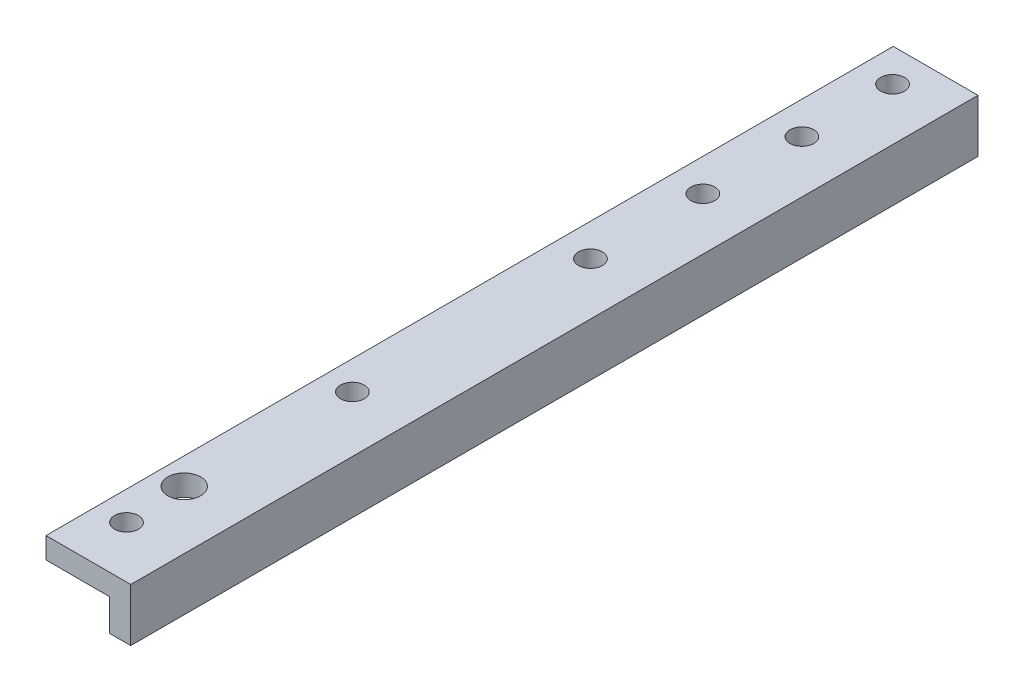
from build123d import *

# Parameters (mm, degrees)
BOSS_EXTRUDE1_DEPTH  = 160
M4_CLEARANCE_HOLE1_D = 4.5
CUT_EXTRUDE2_REACH   = 163.357
SKETCH5_R            = 3.1


with BuildPart() as part:
    # Sketch1 → Boss-Extrude1 (new body)
    with BuildSketch(Plane.XY):
        Polygon((4, -4), (16, -4), (16, -10), (20, -10), (20, 0), (16, 0), (4, 0), align=None)
    extrude(amount=BOSS_EXTRUDE1_DEPTH)

    # M4 Clearance Hole1 (through all)
    with Locations(Plane(origin=(0, -4, 0), x_dir=(-1, 0, 0), z_dir=(0, -1, 0))):
        with Locations((-10.128911503, -6.267286375), (-10.128911503, -23.38156703), (-10.128911503, -42.093180546), (-10.128911503, -63.314888558), (-9.444340277, -107.583827852), (-9.444340277, -150.244789298)):
            Hole(M4_CLEARANCE_HOLE1_D / 2)

    # Sketch5 → Cut-Extrude2 (cut, up to next)
    with BuildSketch(Plane.XZ.offset(4), mode=Mode.PRIVATE) as cut_extrude2_sk1:
        with Locations(Location((9, 138.897931951, 0), (0, 0, 270))):
            Circle(SKETCH5_R)
    cut_extrude2_tool1 = extrude(cut_extrude2_sk1.sketch, amount=-CUT_EXTRUDE2_REACH, mode=Mode.PRIVATE) & part.part
    add(cut_extrude2_tool1.solids().sort_by_distance((9, -4, 138.897932))[0], mode=Mode.SUBTRACT)


solid = part.part
